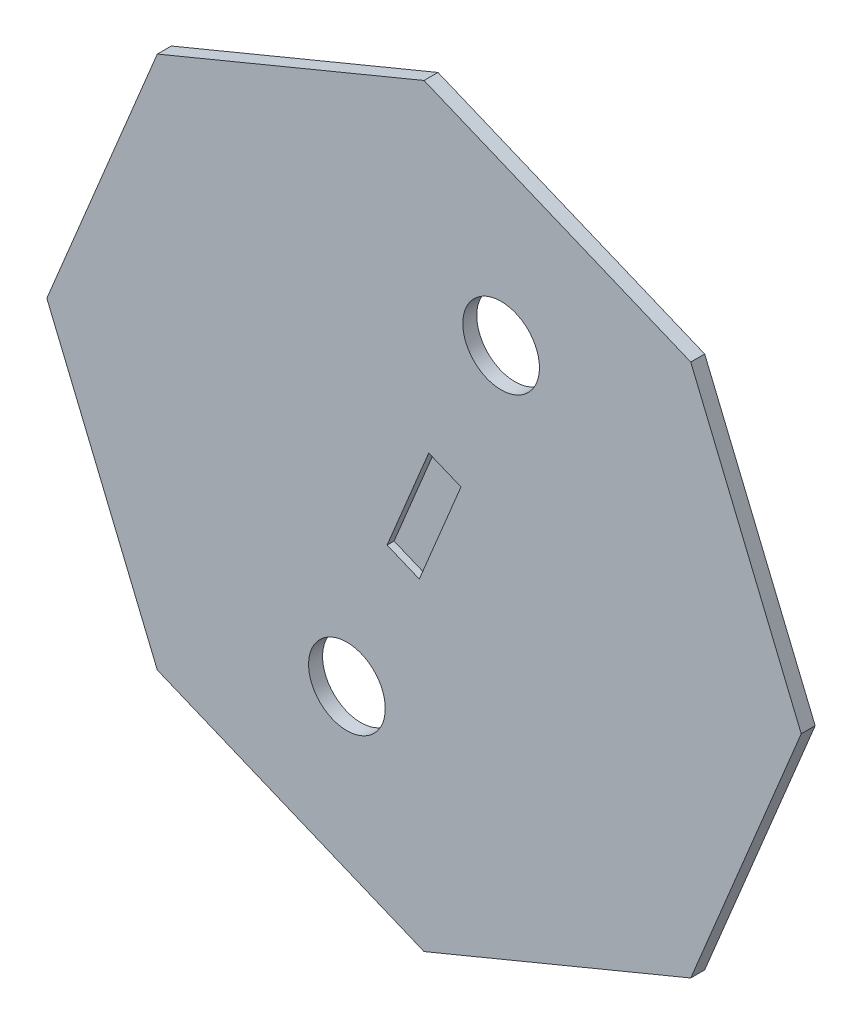
from build123d import *

# Parameters (mm, degrees)
BOSS_EXTRUDE1_DEPTH = 4
CUT_EXTRUDE1_DEPTH  = 2
SKETCH3_R           = 11
CUT_EXTRUDE2_DEPTH  = 154.125626546


with BuildPart() as part:
    # Sketch1 → Boss-Extrude1 (new body)
    with BuildSketch(Plane.XY):
        Polygon((0, -108.239220029), (76.536686473, -76.536686473), (108.239220029, 0), (76.536686473, 76.536686473), (0, 108.239220029), (-76.536686473, 76.536686473), (-108.239220029, 0), (-76.536686473, -76.536686473), align=None)
    extrude(amount=BOSS_EXTRUDE1_DEPTH)

    # Sketch2 → Cut-Extrude1 (cut)
    with BuildSketch(Plane.XY.offset(4)):
        Polygon((-10.598200902, -12.520690706), (-1.359405577, -16.347525029), (10.598200902, 12.520690706), (1.359405577, 16.347525029), align=None)
    extrude(amount=-CUT_EXTRUDE1_DEPTH, mode=Mode.SUBTRACT)

    # Sketch3 → Cut-Extrude2 (cut, through all)
    with BuildSketch(Plane.XY.offset(4)):
        with Locations((-22.123573238, -53.411030559)):
            Circle(SKETCH3_R)
        with Locations((22.123573238, 53.411030559)):
            Circle(SKETCH3_R)
    extrude(amount=-CUT_EXTRUDE2_DEPTH, mode=Mode.SUBTRACT)


solid = part.part
